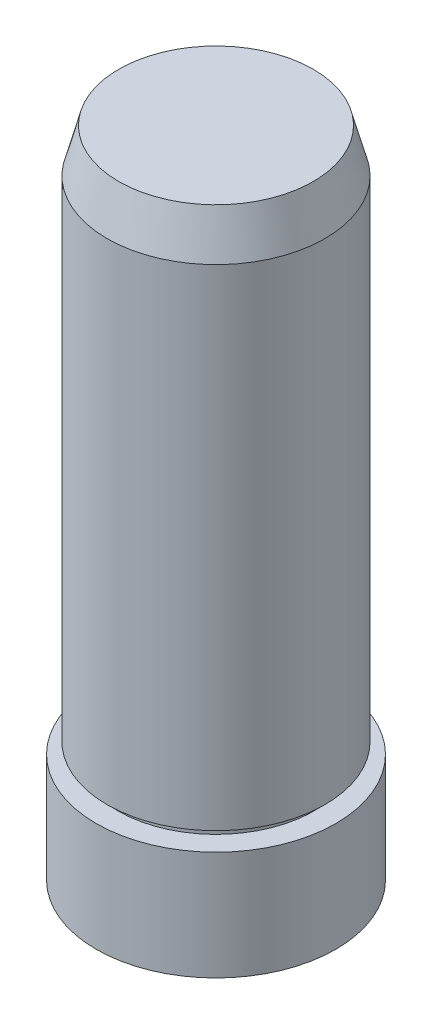
from build123d import *

# Parameters (mm, degrees)
SKETCH_1_R          = 10
EXTRUDE_1_DEPTH     = 50
SKETCH_2_R          = 11
EXTRUDE_2_DEPTH     = 10
CHAMFER_1_SIZE      = 4
CHAMFER_1_SIZE2     = 1.07179677
SKETCH_3_R          = 10
SKETCH_3_R_2        = 9
CUT_EXTRUDE_1_DEPTH = 1


with BuildPart() as part:
    # Эскиз1 → Бобышка-Вытянуть1 (new body)
    with BuildSketch(Plane(origin=(0, 0, 0), x_dir=(1, 0, 0), z_dir=(0, 1, 0))):
        with Locations(Location((0, 0, 0), (0, 0, 270))):
            Circle(SKETCH_1_R)
    extrude(amount=EXTRUDE_1_DEPTH)

    # Эскиз2 → Бобышка-Вытянуть2 (add)
    with BuildSketch(Plane.XZ):
        with Locations(Location((0, 0, 0), (0, 0, 270))):
            Circle(SKETCH_2_R)
    extrude(amount=EXTRUDE_2_DEPTH)

    # Фаска1
    chamfer_1_edges = [part.edges().sort_by_distance(p)[0] for p in [
        (0, 50, -10),
    ]]
    chamfer_1_side = [part.faces().sort_by_distance(p)[0] for p in [
        (0, 25, -10),
    ]]
    chamfer(chamfer_1_edges, length=CHAMFER_1_SIZE, length2=CHAMFER_1_SIZE2, reference=chamfer_1_side[0])

    # Эскиз3 → Вырез-Вытянуть1 (cut)
    with BuildSketch(Plane(origin=(0, 0, 0), x_dir=(1, 0, 0), z_dir=(0, 1, 0))):
        with Locations(Location((0, 0, 0), (0, 0, 270))):
            Circle(SKETCH_3_R)
        with Locations(Location((0, 0, 0), (0, 0, 270))):
            Circle(SKETCH_3_R_2, mode=Mode.SUBTRACT)
    extrude(amount=CUT_EXTRUDE_1_DEPTH, mode=Mode.SUBTRACT)


solid = part.part
